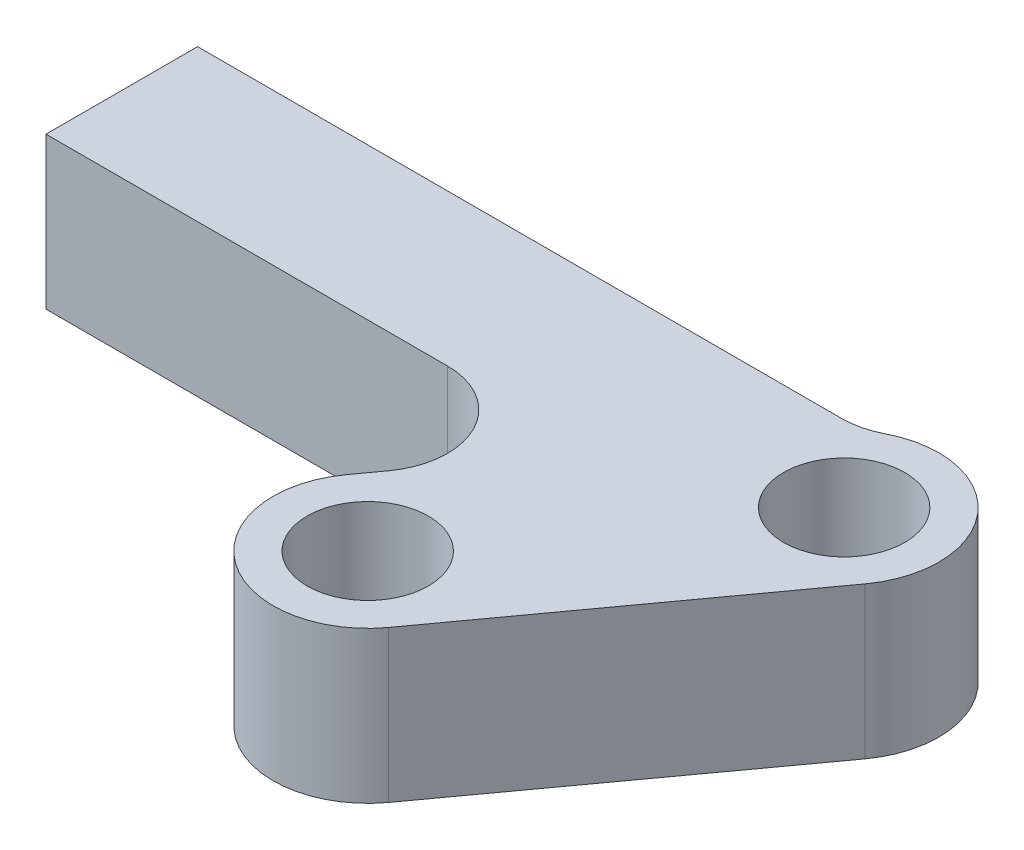
from build123d import *

# Parameters (mm, degrees)
SKETCH_2_R      = 1.6
EXTRUDE_1_DEPTH = 4


with BuildPart() as part:
    # ｽｹｯﾁ2 → ﾎﾞｽ - 押し出し1 (new body)
    with BuildSketch(Plane(origin=(0, 0, 0), x_dir=(1, 0, 0), z_dir=(0, 1, 0))):
        with BuildLine():
            Line((2.022542486, -1.469463131), (-3.267524785, -8.75061608))
            ThreePointArc((-3.267524785, -8.75061608), (-6.759530401, -9.303695435), (-7.312609757, -5.811689819))
            Line((-7.312609757, -5.811689819), (-6.850442022, -5.175570505))
            ThreePointArc((-6.850442022, -5.175570505), (-6.686462962, -3.092019001), (-8.468476011, -2))
            Line((-8.468476011, -2), (-19.061552813, -2))
            Line((-19.061552813, -2), (-19.061552813, 2))
            Line((-19.061552813, 2), (-2.061552813, 2))
            ThreePointArc((-2.061552813, 2), (-1.590148292, 2.056349368), (-1.145307118, 2.222222222))
            ThreePointArc((-1.145307118, 2.222222222), (1.897240274, 1.628029281), (2.022542486, -1.469463131))
        make_face()
        with Locations(Location((0, 0, 0), (0, 0, 270))):
            Circle(SKETCH_2_R, mode=Mode.SUBTRACT)
        with Locations(Location((-5.290067271, -7.281152949, 0), (0, 0, 270))):
            Circle(SKETCH_2_R, mode=Mode.SUBTRACT)
    extrude(amount=EXTRUDE_1_DEPTH)


solid = part.part
